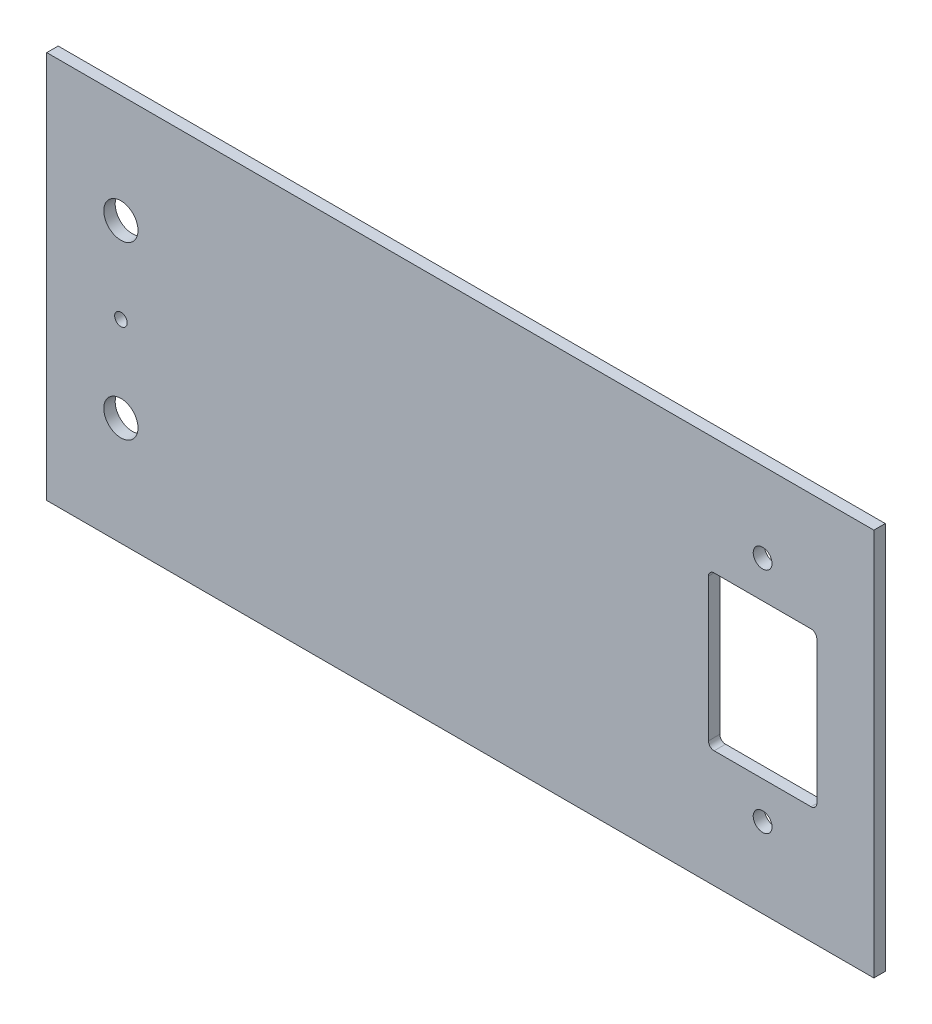
from build123d import *

# Parameters (mm, degrees)
SKETCH1_W           = 145
SKETCH1_H           = 68
BOSS_EXTRUDE1_DEPTH = 2
SKETCH2_R           = 1.65
SKETCH2_R_2         = 3
SKETCH2_R_3         = 1.1
CUT_EXTRUDE1_DEPTH  = 81.101498113


with BuildPart() as part:
    # Sketch1 → Boss-Extrude1 (new body)
    with BuildSketch(Plane.XY):
        Rectangle(SKETCH1_W, SKETCH1_H)
    extrude(amount=BOSS_EXTRUDE1_DEPTH)

    # Sketch2 → Cut-Extrude1 (cut, through all)
    with BuildSketch(Plane.XY.offset(2)):
        with Locations((53, 20)):
            Circle(SKETCH2_R)
        with Locations((53, -20)):
            Circle(SKETCH2_R)
        with Locations((-59.5, 15)):
            Circle(SKETCH2_R_2)
        with Locations((-59.5, -15)):
            Circle(SKETCH2_R_2)
        with Locations((-59.5, 0)):
            Circle(SKETCH2_R_3)
        with BuildLine():
            Line((61.5, -13.5), (44.5, -13.5))
            ThreePointArc((44.5, -13.5), (43.792893219, -13.207106781), (43.5, -12.5))
            Line((43.5, -12.5), (43.5, 12.5))
            ThreePointArc((43.5, 12.5), (43.792893219, 13.207106781), (44.5, 13.5))
            Line((44.5, 13.5), (61.5, 13.5))
            ThreePointArc((61.5, 13.5), (62.207106781, 13.207106781), (62.5, 12.5))
            Line((62.5, 12.5), (62.5, -12.5))
            ThreePointArc((62.5, -12.5), (62.207106781, -13.207106781), (61.5, -13.5))
        make_face()
    extrude(amount=-CUT_EXTRUDE1_DEPTH, mode=Mode.SUBTRACT)


solid = part.part
